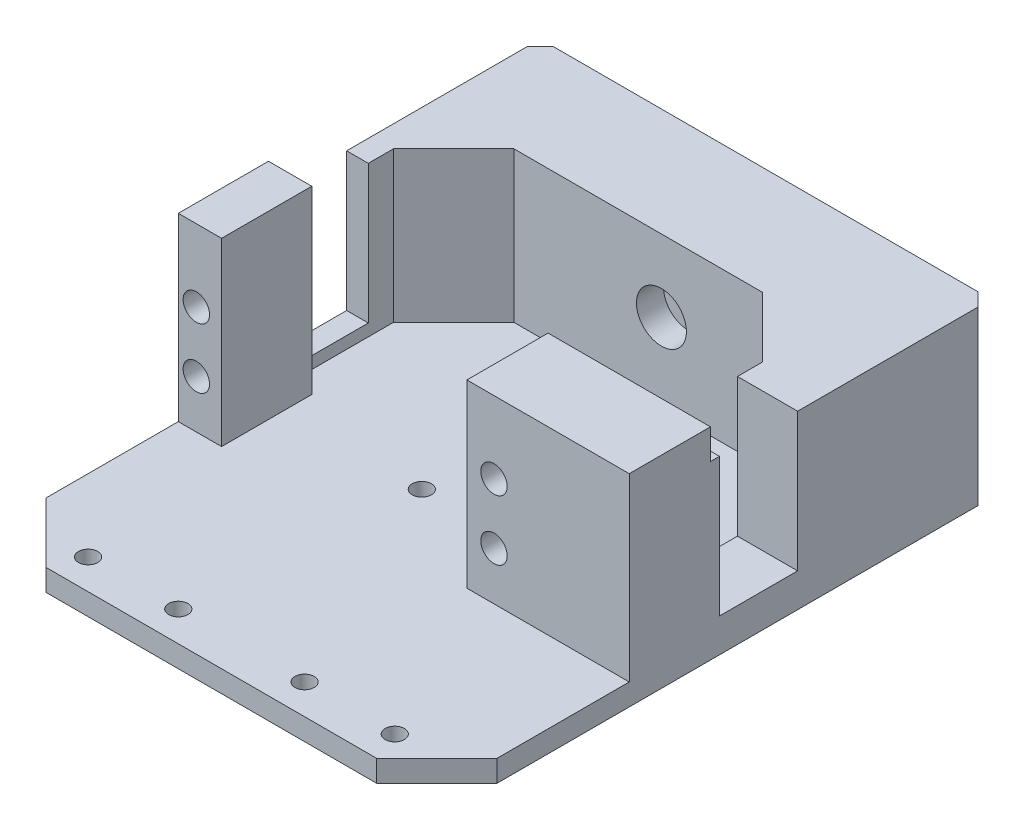
from build123d import *

# Parameters (mm, degrees)
SKETCH_1_W           = 75
SKETCH_1_H           = 100
EXTRUDE_1_DEPTH      = 3.6
CHAMFER_1_SIZE       = 10
SKETCH_2_W           = 5.2
SKETCH_2_H           = 15
SKETCH_2_W_2         = 15
SKETCH_2_H_2         = 13.5
EXTRUDE_2_DEPTH      = 30
SKETCH_3_W           = 15
SKETCH_3_H           = 30
EXTRUDE_3_DEPTH      = 2
SKETCH_4_W           = 13.5
SKETCH_4_H           = 30
EXTRUDE_4_DEPTH      = 12
SKETCH_5_R           = 2.2
CUT_EXTRUDE_1_DEPTH  = 115
SKETCH_6_W           = 49.4
SKETCH_6_H           = 18
EXTRUDE_5_DEPTH      = 25
SKETCH_8_R           = 1.665
CUT_EXTRUDE_3_DEPTH  = 25
EXTRUDE_7_REACH      = 71.327
SKETCH_10_R          = 1.6
CUT_EXTRUDE_4_DEPTH  = 130
SKETCH_12_R          = 1.6
CUT_EXTRUDE_6_DEPTH  = 120
CHAMFER_2_SIZE       = 10
SKETCH_15_W          = 3.6
SKETCH_15_H          = 13
CUT_EXTRUDE_8_DEPTH  = 23
SKETCH_16_R          = 4.155
CUT_EXTRUDE_9_DEPTH  = 4.5
SKETCH_17_W          = 13
SKETCH_17_H          = 23
CUT_EXTRUDE_10_DEPTH = 23
CUT_EXTRUDE_11_DEPTH = 33


with BuildPart() as part:
    # 草图1 → 凸台-拉伸1 (new body)
    with BuildSketch(Plane(origin=(0, 0, 0), x_dir=(1, 0, 0), z_dir=(0, 1, 0))):
        Rectangle(SKETCH_1_W, SKETCH_1_H)
    extrude(amount=EXTRUDE_1_DEPTH)

    # 倒角1
    chamfer_1_edges = [part.edges().sort_by_distance(p)[0] for p in [
        (37.5, 1.8, 50),
        (-37.5, 1.8, 50),
        (-37.5, 1.8, -50),
        (37.5, 1.8, -50),
    ]]
    chamfer(chamfer_1_edges, length=CHAMFER_1_SIZE)

    # 草图2 → 凸台-拉伸2 (add)
    with BuildSketch(Plane(origin=(0, 3.6, 0), x_dir=(1, 0, 0), z_dir=(0, 1, 0))):
        with Locations((-32.9, -10.5)):
            Rectangle(SKETCH_2_W, SKETCH_2_H)
        with Locations((18, -11.25)):
            Rectangle(SKETCH_2_W_2, SKETCH_2_H_2)
    extrude(amount=EXTRUDE_2_DEPTH)

    # 草图3 → 凸台-拉伸3 (add)
    with BuildSketch(Plane.ZY.offset(35.5)):
        with Locations((10.5, 18.6)):
            Rectangle(SKETCH_3_W, SKETCH_3_H)
    extrude(amount=EXTRUDE_3_DEPTH)

    # 草图4 → 凸台-拉伸4 (add)
    with BuildSketch(Plane(origin=(25.5, 0, 0), x_dir=(0, 0, -1), z_dir=(1, 0, 0))):
        with Locations((-11.25, 18.6)):
            Rectangle(SKETCH_4_W, SKETCH_4_H)
    extrude(amount=EXTRUDE_4_DEPTH)

    # 草图5 → 切除-拉伸1 (cut)
    with BuildSketch(Plane.XY.offset(18)):
        with Locations((-34.5, 21.6)):
            Circle(SKETCH_5_R)
        with Locations((-34.5, 11.6)):
            Circle(SKETCH_5_R)
        with Locations((15, 21.6)):
            Circle(SKETCH_5_R)
        with Locations((15, 11.6)):
            Circle(SKETCH_5_R)
    extrude(amount=-CUT_EXTRUDE_1_DEPTH, mode=Mode.SUBTRACT)

    # 草图6 → 凸台-拉伸5 (add)
    with BuildSketch(Plane(origin=(0, 3.6, 0), x_dir=(1, 0, 0), z_dir=(0, 1, 0))):
        with Locations((2.8, 33.2)):
            Rectangle(SKETCH_6_W, SKETCH_6_H)
    extrude(amount=EXTRUDE_5_DEPTH)

    # 草图8 → 切除-拉伸3 (cut)
    with BuildSketch(Plane.XY.offset(-24.2)):
        with Locations((0.65, 16.6)):
            Circle(SKETCH_8_R)
    extrude(amount=-CUT_EXTRUDE_3_DEPTH, mode=Mode.SUBTRACT)

    # 凸台-拉伸7: up to this face of the body (flat: up to its plane)
    extrude_7_end = Plane(part.part.faces().sort_by_distance((2.8, 28.6, -33.2))[0])
    # 草图9 → 凸台-拉伸7 (add, up to the picked face)
    with BuildSketch(Plane(origin=(0, 3.6, 0), x_dir=(1, 0, 0), z_dir=(0, 1, 0)), mode=Mode.PRIVATE) as extrude_7_sk1:
        Polygon((-21.9, 42.2), (-37.5, 42.2), (-37.5, -3), (-33.9, -3), (-33.9, 24.2), (-21.9, 24.2), align=None)
    extrude_7_tool1 = split(extrude(extrude_7_sk1.sketch, amount=EXTRUDE_7_REACH, mode=Mode.PRIVATE), bisect_by=extrude_7_end, keep=Keep.BOTH, mode=Mode.PRIVATE)
    # 草图9 → 凸台-拉伸7 (add, up to the picked face)
    with BuildSketch(Plane(origin=(0, 3.6, 0), x_dir=(1, 0, 0), z_dir=(0, 1, 0)), mode=Mode.PRIVATE) as extrude_7_sk2:
        Polygon((37.5, -4.5), (37.5, 42.2), (27.5, 42.2), (27.5, 24.2), (27.5, -4.5), align=None)
    extrude_7_tool2 = split(extrude(extrude_7_sk2.sketch, amount=EXTRUDE_7_REACH, mode=Mode.PRIVATE), bisect_by=extrude_7_end, keep=Keep.BOTH, mode=Mode.PRIVATE)
    add(extrude_7_tool1.solids().sort_by(Axis((-31.251331, 3.6, -27.356654), (0, 1, 0)))[0])
    add(extrude_7_tool2.solids().sort_by(Axis((32.5, 3.6, -18.85), (0, 1, 0)))[0])

    # 草图10 → 切除-拉伸4 (cut)
    with BuildSketch(Plane(origin=(0, 3.6, 0), x_dir=(1, 0, 0), z_dir=(0, 1, 0))):
        with Locations(Location((-7.5, 7.5, 0), (0, 0, 270))):
            Circle(SKETCH_10_R)
        with Locations(Location((7.5, 7.5, 0), (0, 0, 90))):
            Circle(SKETCH_10_R)
        with Locations(Location((7.5, -7.5, 0), (0, 0, 270))):
            Circle(SKETCH_10_R)
        with Locations(Location((-7.5, -7.5, 0), (0, 0, 90))):
            Circle(SKETCH_10_R)
    extrude(amount=-CUT_EXTRUDE_4_DEPTH, mode=Mode.SUBTRACT)

    # 草图12 → 切除-拉伸6 (cut)
    with BuildSketch(Plane(origin=(0, 3.6, 0), x_dir=(1, 0, 0), z_dir=(0, 1, 0))):
        with Locations(Location((-25.5, 45, 0), (0, 0, 270))):
            Circle(SKETCH_12_R)
        with Locations(Location((-10.5, 45, 0), (0, 0, 270))):
            Circle(SKETCH_12_R)
        with Locations(Location((10.5, 45, 0), (0, 0, 90))):
            Circle(SKETCH_12_R)
        with Locations(Location((25.5, 45, 0), (0, 0, 90))):
            Circle(SKETCH_12_R)
        with Locations(Location((25.5, -45, 0), (0, 0, 270))):
            Circle(SKETCH_12_R)
        with Locations(Location((10.5, -45, 0), (0, 0, 270))):
            Circle(SKETCH_12_R)
        with Locations(Location((-10.5, -45, 0), (0, 0, 90))):
            Circle(SKETCH_12_R)
        with Locations(Location((-25.5, -45, 0), (0, 0, 90))):
            Circle(SKETCH_12_R)
    extrude(amount=-CUT_EXTRUDE_6_DEPTH, mode=Mode.SUBTRACT)

    # 倒角2
    chamfer_2_edges = [part.edges().sort_by_distance(p)[0] for p in [
        (27.5, 16.1, -24.2),
        (-33.9, 16.1, -24.2),
    ]]
    chamfer(chamfer_2_edges, length=CHAMFER_2_SIZE)

    # 草图15 → 切除-拉伸8 (cut)
    with BuildSketch(Plane(origin=(0, 28.6, 0), x_dir=(1, 0, 0), z_dir=(0, 1, 0))):
        with Locations((-35.7, 3.5)):
            Rectangle(SKETCH_15_W, SKETCH_15_H)
    extrude(amount=-CUT_EXTRUDE_8_DEPTH, mode=Mode.SUBTRACT)

    # 草图16 → 切除-拉伸9 (cut)
    with BuildSketch(Plane.XY.offset(-24.2)):
        with Locations((0.65, 16.6)):
            Circle(SKETCH_16_R)
    extrude(amount=-CUT_EXTRUDE_9_DEPTH, mode=Mode.SUBTRACT)

    # 草图17 → 切除-拉伸10 (cut)
    with BuildSketch(Plane.ZY.offset(-27.5)):
        with Locations((-3.5, 17.1)):
            Rectangle(SKETCH_17_W, SKETCH_17_H)
    extrude(amount=-CUT_EXTRUDE_10_DEPTH, mode=Mode.SUBTRACT)

    # 草图18 → 切除-拉伸11 (cut)
    with BuildSketch(Plane.XZ):
        Polygon((-37.5, -40), (-35.3, -42.2), (-37.5, -42.2), align=None)
        Polygon((37.5, -42.2), (37.5, -40), (35.3, -42.2), align=None)
    extrude(amount=-CUT_EXTRUDE_11_DEPTH, mode=Mode.SUBTRACT)


solid = part.part
